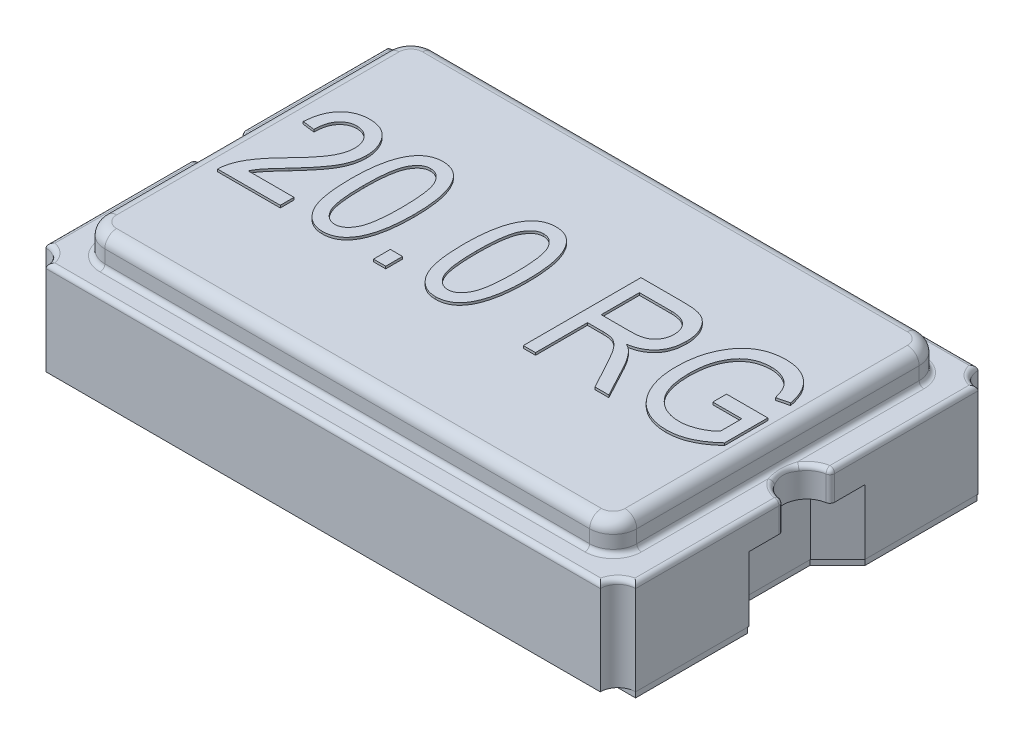
from build123d import *

# Parameters (mm, degrees)
EXTRUDE_6_DEPTH   = 0.05
EXTRUDE_6_2_DEPTH = 0.05
EXTRUDE_21_DEPTH  = 0.55
EXTRUDE_22_DEPTH  = 0.25
SKETCH_11_W       = 4.52
SKETCH_11_H       = 2.8
EXTRUDE_23_DEPTH  = 0.25
FILLET_1_R        = 0.2
FILLET_2_R        = 0.1
FILLET_5_R        = 0.04
FILLET_6_R        = 0.04
SKETCH_12_W       = 0.103896104
SKETCH_12_H       = 0.142857143
EXTRUDE_24_DEPTH  = 0.02


with BuildPart() as part:
    # Эскиз1 → Вытянуть6 (new body)
    with BuildSketch(Plane(origin=(0, 0, 0), x_dir=(1, 0, 0), z_dir=(0, 1, 0))):
        Polygon((-2.5, 0.5), (-2.5, 1.45), (-1.2, 1.45), (-1.2, -1.45), (-2.5, -1.45), (-2.5, -0.5), (-2.265625, -0.265625), (-2.265625, 0.265625), align=None)
    extrude(amount=EXTRUDE_6_DEPTH)



with BuildPart() as body_2:
    # Эскиз1 → Extrude 6 2 (new body)
    with BuildSketch(Plane(origin=(0, 0, 0), x_dir=(1, 0, 0), z_dir=(0, 1, 0))):
        Polygon((2.5, 0.5), (2.5, 1.45), (1.2, 1.45), (1.2, -1.45), (2.5, -1.45), (2.5, -0.5), (2.265625, -0.265625), (2.265625, 0.265625), align=None)
    extrude(amount=EXTRUDE_6_2_DEPTH)


with BuildPart() as part_1:
    add(part.part)

    add(body_2.part)  # Вытянуть21 merges body 2
    # Эскиз10 → Вытянуть21 (add)
    with BuildSketch(Plane(origin=(0, 0.05, 0), x_dir=(1, 0, 0), z_dir=(0, 1, 0))):
        with BuildLine():
            Line((-2.355, 1.605), (2.355, 1.605))
            ThreePointArc((2.355, 1.605), (2.398933983, 1.498933983), (2.505, 1.455))
            Line((2.505, 1.455), (2.505, 0.492726452))
            Line((2.505, 0.492726452), (2.273399929, 0.261126382))
            Line((2.273399929, 0.261126382), (2.273399929, -0.260815994))
            Line((2.273399929, -0.260815994), (2.505, -0.492416065))
            Line((2.505, -0.492416065), (2.505, -1.455))
            ThreePointArc((2.505, -1.455), (2.398933983, -1.498933983), (2.355, -1.605))
            Line((2.355, -1.605), (-2.355, -1.605))
            ThreePointArc((-2.355, -1.605), (-2.398933983, -1.498933983), (-2.505, -1.455))
            Line((-2.505, -1.455), (-2.505, -0.492416065))
            Line((-2.505, -0.492416065), (-2.273399929, -0.260815994))
            Line((-2.273399929, -0.260815994), (-2.273399929, 0.261126382))
            Line((-2.273399929, 0.261126382), (-2.505, 0.492726452))
            Line((-2.505, 0.492726452), (-2.505, 1.455))
            ThreePointArc((-2.505, 1.455), (-2.398933983, 1.498933983), (-2.355, 1.605))
        make_face()
    extrude(amount=EXTRUDE_21_DEPTH)

    # Эскиз9 → Вытянуть22 (add)
    with BuildSketch(Plane(origin=(0, 0.6, 1.605), x_dir=(-1, 0, 0), z_dir=(0, 1, 0))):
        with BuildLine():
            Line((2.355, -3.21), (-2.355, -3.21))
            ThreePointArc((-2.355, -3.21), (-2.398933983, -3.103933983), (-2.505, -3.06))
            Line((-2.505, -3.06), (-2.505, -1.805))
            ThreePointArc((-2.505, -1.805), (-2.305, -1.605), (-2.505, -1.405))
            Line((-2.505, -1.405), (-2.505, -0.15))
            ThreePointArc((-2.505, -0.15), (-2.398933983, -0.106066017), (-2.355, 0))
            Line((-2.355, 0), (2.355, 0))
            ThreePointArc((2.355, 0), (2.398933983, -0.106066017), (2.505, -0.15))
            Line((2.505, -0.15), (2.505, -1.405))
            ThreePointArc((2.505, -1.405), (2.305, -1.605), (2.505, -1.805))
            Line((2.505, -1.805), (2.505, -3.06))
            ThreePointArc((2.505, -3.06), (2.398933983, -3.103933983), (2.355, -3.21))
        make_face()
    extrude(amount=EXTRUDE_22_DEPTH)

    # Эскиз11 → Вытянуть23 (add)
    with BuildSketch(Plane(origin=(0, 0.85, 0), x_dir=(1, 0, 0), z_dir=(0, 1, 0))):
        Rectangle(SKETCH_11_W, SKETCH_11_H)
    extrude(amount=EXTRUDE_23_DEPTH)

    # Скругление1
    fillet_1_edges = [part_1.edges().sort_by_distance(p)[0] for p in [
        (-2.26, 0.975, -1.4),
        (-2.26, 0.975, 1.4),
        (2.26, 0.975, 1.4),
        (2.26, 0.975, -1.4),
    ]]
    fillet(fillet_1_edges, radius=FILLET_1_R)

    # Скругление2
    fillet_2_edges = [part_1.edges().sort_by_distance(p)[0] for p in [
        (2.26, 1.1, 0),
        (0, 1.1, 1.4),
        (-2.26, 1.1, 0),
        (0, 1.1, -1.4),
        (-2.201421356, 1.1, 1.341421356),
        (-2.201421356, 1.1, -1.341421356),
        (2.201421356, 1.1, -1.341421356),
        (2.201421356, 1.1, 1.341421356),
    ]]
    fillet(fillet_2_edges, radius=FILLET_2_R)

    # Скругление5
    fillet_5_edges = [part_1.edges().sort_by_distance(p)[0] for p in [
        (2.26, 0.85, 0),
        (0, 0.85, 1.4),
        (0, 0.85, -1.4),
        (-2.26, 0.85, 0),
        (2.201421356, 0.85, 1.341421356),
        (2.201421356, 0.85, -1.341421356),
        (-2.201421356, 0.85, -1.341421356),
        (-2.201421356, 0.85, 1.341421356),
        (-2.398933983, 0.85, -1.498933983),
        (-2.505, 0.85, -0.8275),
        (-2.505, 0.85, 0.8275),
        (-2.398933983, 0.85, 1.498933983),
        (0, 0.85, 1.605),
        (2.398933983, 0.85, 1.498933983),
        (2.505, 0.85, 0.8275),
        (2.505, 0.85, -0.8275),
        (2.398933983, 0.85, -1.498933983),
        (0, 0.85, -1.605),
    ]]
    fillet(fillet_5_edges, radius=FILLET_5_R)

    # Скругление6
    fillet_6_edges = [part_1.edges().sort_by_distance(p)[0] for p in [
        (2.505, 0.705, 0.2),
        (2.493196308, 0.838371965, 0.199651376),
        (2.505, 0.705, -0.2),
        (2.493196307, 0.838371965, -0.199651376),
        (-2.505, 0.705, -0.2),
        (-2.493196306, 0.838371967, -0.199651376),
        (-2.505, 0.705, 0.2),
        (-2.493196306, 0.838371967, 0.199651376),
        (2.305, 0.85, 0),
        (-2.305, 0.85, 0),
    ]]
    fillet(fillet_6_edges, radius=FILLET_6_R)

    # Эскиз12 → Вытянуть24 (add)
    # profile 1 of 6: a face of its own
    with BuildSketch(Plane(origin=(0, 1.1, 0), x_dir=(1, 0, 0), z_dir=(0, 1, 0))):
        with BuildLine():
            Line((-1.515584416, -0.336634927), (-1.515584416, -0.453518044))
            Line((-1.515584416, -0.453518044), (-2.048051948, -0.453518044))
            add(Edge.make_bspline(
                [(-2.048051948, -0.453518044), (-2.048076602, -0.447427945), (-2.04812655, -0.435089304), (-2.046465918, -0.416277957), (-2.043054005, -0.397011176), (-2.038697342, -0.37703194), (-2.032520067, -0.356603018), (-2.024957938, -0.335625147), (-2.01603529, -0.314150555), (-2.005587684, -0.292052059), (-1.993379129, -0.269117691), (-1.978646943, -0.2454434), (-1.961716008, -0.220604526), (-1.942563933, -0.194752492), (-1.920816148, -0.168132476), (-1.897118152, -0.140349305), (-1.871131741, -0.111460848), (-1.852629362, -0.092261311), (-1.843100649, -0.082373564)],
                knots=[0, 0, 0, 0, 0.672188691, 1.361865275, 2.08134618, 2.831455259, 3.618325166, 4.435686407, 5.292818481, 6.184803937, 7.133719261, 8.159707436, 9.261705982, 10.452168352, 11.710682541, 13.056179633, 14.483934645, 16, 16, 16, 16], degree=3))
            add(Edge.make_bspline(
                [(-1.843100649, -0.082373564), (-1.832027218, -0.070919994), (-1.810706186, -0.048867035), (-1.780698871, -0.016304491), (-1.753434211, 0.013961989), (-1.729456937, 0.042479713), (-1.708341364, 0.068860277), (-1.689875048, 0.093065962), (-1.674940492, 0.115646102), (-1.658815419, 0.14221488), (-1.643442452, 0.173844589), (-1.629851878, 0.21071402), (-1.621070628, 0.246355788), (-1.620000237, 0.269853646), (-1.619480519, 0.2812628)],
                knots=[0, 0, 0, 0, 1.312560889, 2.527233899, 3.64818266, 4.668586789, 5.596397896, 6.432357998, 7.175835261, 7.825761013, 8.992224112, 10.065918602, 11.060925749, 12, 12, 12, 12], degree=3))
            add(Edge.make_bspline(
                [(-1.619480519, 0.2812628), (-1.619552987, 0.287561562), (-1.619694524, 0.299863702), (-1.622099742, 0.317829661), (-1.625529901, 0.334918072), (-1.630058727, 0.351252434), (-1.63648008, 0.366564452), (-1.644173944, 0.380960362), (-1.653186214, 0.394505365), (-1.663470582, 0.407000547), (-1.674811901, 0.418272763), (-1.686764059, 0.428399433), (-1.699637983, 0.43659549), (-1.712904551, 0.443730323), (-1.727012067, 0.448901214), (-1.741663463, 0.452842769), (-1.756994292, 0.455065198), (-1.767404031, 0.455401965), (-1.772686688, 0.455572865)],
                knots=[0, 0, 0, 0, 1.164486654, 2.274364258, 3.346924328, 4.388668322, 5.404300818, 6.412115579, 7.404820287, 8.409522099, 9.400647826, 10.360464378, 11.301161788, 12.219192522, 13.141987859, 14.073903283, 15.022558797, 16, 16, 16, 16], degree=3))
            add(Edge.make_bspline(
                [(-1.772686688, 0.455572865), (-1.778382429, 0.455453375), (-1.789500775, 0.455220126), (-1.80570649, 0.452321466), (-1.821234542, 0.448443632), (-1.836006134, 0.44242945), (-1.849913219, 0.434725648), (-1.863156136, 0.425452657), (-1.875475671, 0.414435197), (-1.887119992, 0.401907027), (-1.897327722, 0.387620942), (-1.906699916, 0.372161837), (-1.914080124, 0.354874864), (-1.92035543, 0.336293067), (-1.925269982, 0.316199844), (-1.928554968, 0.294670976), (-1.93096401, 0.27171171), (-1.931099302, 0.255904383), (-1.931168831, 0.247780657)],
                knots=[0, 0, 0, 0, 0.928788257, 1.813037313, 2.680996359, 3.53827917, 4.408273621, 5.272359245, 6.172129225, 7.102295458, 8.058839945, 9.034325244, 10.048074492, 11.120300332, 12.234644845, 13.420320921, 14.674247329, 16, 16, 16, 16], degree=3))
            Line((-1.931168831, 0.247780657), (-2.035064935, 0.26076767))
            add(Edge.make_bspline(
                [(-2.035064935, 0.26076767), (-2.033994235, 0.272823987), (-2.031917029, 0.296213789), (-2.026467017, 0.330074158), (-2.018904145, 0.361490515), (-2.009926543, 0.390776276), (-1.998631686, 0.417567989), (-1.986003677, 0.442353233), (-1.971036462, 0.464593221), (-1.954345548, 0.484562901), (-1.936070715, 0.502280079), (-1.916314962, 0.517573151), (-1.895105115, 0.530464921), (-1.872683395, 0.541304821), (-1.848586331, 0.549399576), (-1.823246225, 0.555274566), (-1.796456978, 0.558755192), (-1.778175793, 0.559227529), (-1.768831169, 0.559468969)],
                knots=[0, 0, 0, 0, 1.296155121, 2.514599762, 3.669097984, 4.755193195, 5.79120272, 6.77953026, 7.729955905, 8.65570694, 9.562583864, 10.450894749, 11.325630111, 12.216772649, 13.112585423, 14.04224033, 14.999270054, 16, 16, 16, 16], degree=3))
            add(Edge.make_bspline(
                [(-1.768831169, 0.559468969), (-1.758741678, 0.559172803), (-1.739095765, 0.558596118), (-1.710495945, 0.554796226), (-1.683821384, 0.548093473), (-1.658952939, 0.538766487), (-1.63618927, 0.526487768), (-1.615160106, 0.511759109), (-1.596216399, 0.494132773), (-1.579358228, 0.474076491), (-1.564459845, 0.452423326), (-1.551460032, 0.429781562), (-1.540183738, 0.40652637), (-1.531370995, 0.382398984), (-1.524011417, 0.357723212), (-1.519387969, 0.332125001), (-1.516133095, 0.305899708), (-1.515768342, 0.288172489), (-1.515584416, 0.279233579)],
                knots=[0, 0, 0, 0, 1.141256367, 2.222215694, 3.255808886, 4.246221905, 5.218350639, 6.173592628, 7.142736081, 8.136099926, 9.131465336, 10.11177911, 11.087094076, 12.050634184, 13.014356534, 13.995714735, 14.989343724, 16, 16, 16, 16], degree=3))
            add(Edge.make_bspline(
                [(-1.515584416, 0.279233579), (-1.515757709, 0.271180013), (-1.516102038, 0.255177805), (-1.518341927, 0.231301602), (-1.522295746, 0.207746397), (-1.527429606, 0.184285699), (-1.534714589, 0.161282762), (-1.542961578, 0.138372245), (-1.552964536, 0.115812608), (-1.564773277, 0.093163493), (-1.578599779, 0.069623402), (-1.5951685, 0.044762703), (-1.614172174, 0.017916859), (-1.636382701, -0.010435796), (-1.660723869, -0.041110606), (-1.68827103, -0.073334654), (-1.718486723, -0.107392099), (-1.739774558, -0.130501168), (-1.750771104, -0.142438499)],
                knots=[0, 0, 0, 0, 0.78053567, 1.550902233, 2.321464013, 3.094364546, 3.87611052, 4.657966429, 5.453363508, 6.265521698, 7.132350641, 8.097801917, 9.160103787, 10.319208993, 11.587678713, 12.955014444, 14.427067756, 16, 16, 16, 16], degree=3))
            add(Edge.make_bspline(
                [(-1.750771104, -0.142438499), (-1.757752087, -0.149865925), (-1.771093306, -0.164060332), (-1.789986071, -0.184599818), (-1.806939674, -0.203284333), (-1.822323226, -0.219850833), (-1.835376199, -0.234856451), (-1.846692969, -0.247904793), (-1.85593964, -0.259156692), (-1.869797496, -0.27684538), (-1.887275844, -0.301768582), (-1.89935125, -0.325264657), (-1.905194805, -0.336634927)],
                knots=[0, 0, 0, 0, 1.227496676, 2.345844757, 3.360613726, 4.265798447, 5.068085109, 5.75545707, 6.345771879, 6.821573405, 8.46188917, 10, 10, 10, 10], degree=3))
            Line((-1.905194805, -0.336634927), (-1.515584416, -0.336634927))
        make_face()
    # profile 2 of 6: a face of its own
    with BuildSketch(Plane(origin=(0, 1.1, 0), x_dir=(1, 0, 0), z_dir=(0, 1, 0))):
        with BuildLine():
            add(Edge.make_bspline(
                [(-1.411688312, 0.046076112), (-1.411523328, 0.06650825), (-1.41120297, 0.10618255), (-1.407892135, 0.163725629), (-1.402669969, 0.217483649), (-1.395568528, 0.267384527), (-1.385957565, 0.313435753), (-1.374639694, 0.355711211), (-1.360739093, 0.39407646), (-1.345093107, 0.428696009), (-1.32715076, 0.459376551), (-1.307370081, 0.486223515), (-1.285164304, 0.508801175), (-1.261145725, 0.527575378), (-1.234836527, 0.541878035), (-1.206611173, 0.552157063), (-1.176365323, 0.558359848), (-1.155494628, 0.559094253), (-1.144845779, 0.559468969)],
                knots=[0, 0, 0, 0, 1.522295809, 2.955932353, 4.292935845, 5.545987552, 6.709403679, 7.796379217, 8.803980711, 9.746667296, 10.623167879, 11.447716403, 12.224665142, 12.975696349, 13.710987297, 14.4460191, 15.207112772, 16, 16, 16, 16], degree=3))
            add(Edge.make_bspline(
                [(-1.144845779, 0.559468969), (-1.135355954, 0.559164541), (-1.11672011, 0.558566716), (-1.089525699, 0.553636707), (-1.063947598, 0.545249609), (-1.039966488, 0.533594041), (-1.017655214, 0.518545654), (-0.99679426, 0.500350276), (-0.977612231, 0.47864105), (-0.96650478, 0.462332318), (-0.960795455, 0.453949488)],
                knots=[0, 0, 0, 0, 1.02435884, 2.0116063, 2.972586715, 3.92329494, 4.881606269, 5.870473939, 6.905405214, 8, 8, 8, 8], degree=3))
            add(Edge.make_bspline(
                [(-0.960795455, 0.453949488), (-0.954186747, 0.442647536), (-0.940443243, 0.419143933), (-0.924032833, 0.379764164), (-0.910200371, 0.335780267), (-0.898537401, 0.28705226), (-0.890217938, 0.233479667), (-0.883633593, 0.175270882), (-0.879822897, 0.112279589), (-0.879426299, 0.068673196), (-0.879220779, 0.046076112)],
                knots=[0, 0, 0, 0, 0.745747152, 1.550859881, 2.42529298, 3.372802996, 4.404287875, 5.514077945, 6.711780846, 8, 8, 8, 8], degree=3))
            add(Edge.make_bspline(
                [(-0.879220779, 0.046076112), (-0.879383763, 0.025778995), (-0.879700176, -0.013625443), (-0.883044144, -0.070894479), (-0.888196731, -0.124391268), (-0.895394626, -0.174139948), (-0.904916457, -0.220078117), (-0.91638471, -0.262342079), (-0.929851493, -0.30091312), (-0.945714052, -0.33553636), (-0.963392273, -0.366395903), (-0.983508508, -0.392970813), (-1.005179126, -0.415952012), (-1.029509477, -0.43431957), (-1.055639162, -0.449027063), (-1.08405474, -0.459132844), (-1.114401412, -0.465422566), (-1.135344455, -0.466138589), (-1.146063312, -0.466505057)],
                knots=[0, 0, 0, 0, 1.513874866, 2.939007974, 4.277477108, 5.521918538, 6.686610019, 7.774777114, 8.786532326, 9.730252297, 10.61206932, 11.433487149, 12.211385775, 12.960169701, 13.698700869, 14.439280195, 15.201208188, 16, 16, 16, 16], degree=3))
            add(Edge.make_bspline(
                [(-1.146063312, -0.466505057), (-1.155623702, -0.46614622), (-1.174420506, -0.465440706), (-1.202000363, -0.460076557), (-1.228103193, -0.450827771), (-1.252866881, -0.43812138), (-1.276324347, -0.42187637), (-1.298188984, -0.401750559), (-1.318989048, -0.378273725), (-1.338474377, -0.35101305), (-1.356082337, -0.319267794), (-1.370966716, -0.282282366), (-1.383647752, -0.240233435), (-1.393710767, -0.192951237), (-1.402180801, -0.140629029), (-1.407503893, -0.08300438), (-1.411032101, -0.020188487), (-1.411463861, 0.023410969), (-1.411688312, 0.046076112)],
                knots=[0, 0, 0, 0, 0.713782411, 1.403376538, 2.088831486, 2.775699897, 3.476400496, 4.213162367, 4.989742879, 5.815463779, 6.710980744, 7.6941898, 8.787315853, 9.987366569, 11.302150399, 12.743876293, 14.307306722, 16, 16, 16, 16], degree=3))
        make_face()
        with BuildLine():
            add(Edge.make_bspline(
                [(-1.307792208, 0.046481956), (-1.307611045, 0.027000043), (-1.30726497, -0.010216195), (-1.305363086, -0.06362203), (-1.30176834, -0.111954442), (-1.296775606, -0.155365719), (-1.29044564, -0.193676542), (-1.282633006, -0.22709784), (-1.273323485, -0.255493717), (-1.262370832, -0.279268475), (-1.250225099, -0.29900458), (-1.23725189, -0.315822075), (-1.223837996, -0.330407322), (-1.209174787, -0.342057977), (-1.193951618, -0.351478352), (-1.177580243, -0.357625169), (-1.160638139, -0.362061897), (-1.148933759, -0.362425316), (-1.143019481, -0.362608953)],
                knots=[0, 0, 0, 0, 1.930873368, 3.688541263, 5.295281011, 6.732986767, 8.018032389, 9.141589856, 10.131594649, 10.974379403, 11.729767228, 12.422984227, 13.077418253, 13.687793181, 14.274134012, 14.843047171, 15.415386244, 16, 16, 16, 16], degree=3))
            add(Edge.make_bspline(
                [(-1.143019481, -0.362608953), (-1.137444381, -0.362416409), (-1.126343471, -0.362033024), (-1.110161842, -0.357641593), (-1.094562007, -0.351199853), (-1.079806142, -0.341877012), (-1.065915436, -0.329886024), (-1.052701627, -0.315327878), (-1.040145039, -0.29818657), (-1.028104024, -0.278154513), (-1.017267739, -0.254258972), (-1.00805065, -0.225728161), (-1.000294972, -0.192317584), (-0.993879638, -0.154026699), (-0.989231929, -0.110787059), (-0.985510965, -0.062746558), (-0.983658461, -0.009741714), (-0.983302586, 0.027203316), (-0.983116883, 0.046481956)],
                knots=[0, 0, 0, 0, 0.556098029, 1.107279675, 1.665020537, 2.239289732, 2.843790749, 3.494855459, 4.20099618, 4.965402842, 5.827994078, 6.818278647, 7.958442113, 9.254955883, 10.697998423, 12.305588537, 14.072183745, 16, 16, 16, 16], degree=3))
            add(Edge.make_bspline(
                [(-0.983116883, 0.046481956), (-0.983301759, 0.065963637), (-0.98365621, 0.10331461), (-0.985517166, 0.156791099), (-0.989177137, 0.205251974), (-0.994081539, 0.248609361), (-1.000532838, 0.286962017), (-1.00819074, 0.320359983), (-1.017652477, 0.348698723), (-1.028449588, 0.372426059), (-1.040842531, 0.391986593), (-1.053495977, 0.409059347), (-1.067362322, 0.423283734), (-1.081937349, 0.435128276), (-1.097433326, 0.444357975), (-1.113918254, 0.450953342), (-1.131263964, 0.454922118), (-1.143134438, 0.455355038), (-1.149107143, 0.455572865)],
                knots=[0, 0, 0, 0, 1.926173374, 3.692928135, 5.28908838, 6.72993665, 8.005261178, 9.132588719, 10.113846285, 10.954579593, 11.702439438, 12.399284011, 13.051919516, 13.660808713, 14.251466784, 14.827675714, 15.41013748, 16, 16, 16, 16], degree=3))
            add(Edge.make_bspline(
                [(-1.149107143, 0.455572865), (-1.15468315, 0.455385408), (-1.165720149, 0.45501436), (-1.181767238, 0.45060442), (-1.197162046, 0.444156348), (-1.211809817, 0.434792038), (-1.22552572, 0.422632062), (-1.238846685, 0.408164083), (-1.25112789, 0.390868185), (-1.26321306, 0.371019511), (-1.273859316, 0.34706006), (-1.283090705, 0.318578881), (-1.290515403, 0.285108368), (-1.297076323, 0.246932702), (-1.30166464, 0.203748319), (-1.305401991, 0.155711288), (-1.307249519, 0.10270539), (-1.307606124, 0.065760515), (-1.307792208, 0.046481956)],
                knots=[0, 0, 0, 0, 0.557102101, 1.102712893, 1.655222221, 2.224793741, 2.834805151, 3.487045402, 4.190458401, 4.956245252, 5.811421647, 6.809929224, 7.950602775, 9.242777249, 10.688425301, 12.298918027, 14.068702942, 16, 16, 16, 16], degree=3))
        make_face(mode=Mode.SUBTRACT)
    # profile 3 of 6: a face of its own
    with BuildSketch(Plane(origin=(0, 1.1, 0), x_dir=(1, 0, 0), z_dir=(0, 1, 0))):
        with Locations((-0.671428571, -0.382089473)):
            Rectangle(SKETCH_12_W, SKETCH_12_H)
    # profile 4 of 6: a face of its own
    with BuildSketch(Plane(origin=(0, 1.1, 0), x_dir=(1, 0, 0), z_dir=(0, 1, 0))):
        with BuildLine():
            add(Edge.make_bspline(
                [(-0.450649351, 0.046076112), (-0.450484367, 0.06650825), (-0.450164009, 0.10618255), (-0.446853174, 0.163725629), (-0.441631008, 0.217483649), (-0.434529567, 0.267384527), (-0.424918604, 0.313435753), (-0.413600733, 0.355711211), (-0.399700132, 0.39407646), (-0.384054146, 0.428696009), (-0.366111799, 0.459376551), (-0.34633112, 0.486223515), (-0.324125343, 0.508801175), (-0.300106764, 0.527575378), (-0.273797566, 0.541878035), (-0.245572212, 0.552157063), (-0.215326362, 0.558359848), (-0.194455667, 0.559094253), (-0.183806818, 0.559468969)],
                knots=[0, 0, 0, 0, 1.522295809, 2.955932353, 4.292935845, 5.545987552, 6.709403679, 7.796379217, 8.803980711, 9.746667296, 10.623167879, 11.447716403, 12.224665142, 12.975696349, 13.710987297, 14.4460191, 15.207112772, 16, 16, 16, 16], degree=3))
            add(Edge.make_bspline(
                [(-0.183806818, 0.559468969), (-0.174316993, 0.559164541), (-0.155681149, 0.558566716), (-0.128486738, 0.553636707), (-0.102908637, 0.545249609), (-0.078927527, 0.533594041), (-0.056616253, 0.518545654), (-0.035755299, 0.500350276), (-0.01657327, 0.47864105), (-0.005465819, 0.462332318), (0.000243506, 0.453949488)],
                knots=[0, 0, 0, 0, 1.02435884, 2.0116063, 2.972586715, 3.92329494, 4.881606269, 5.870473939, 6.905405214, 8, 8, 8, 8], degree=3))
            add(Edge.make_bspline(
                [(0.000243506, 0.453949488), (0.006852214, 0.442647536), (0.020595718, 0.419143933), (0.037006128, 0.379764164), (0.05083859, 0.335780267), (0.06250156, 0.28705226), (0.070821023, 0.233479667), (0.077405368, 0.175270882), (0.081216064, 0.112279589), (0.081612662, 0.068673196), (0.081818182, 0.046076112)],
                knots=[0, 0, 0, 0, 0.745747152, 1.550859881, 2.42529298, 3.372802996, 4.404287875, 5.514077945, 6.711780846, 8, 8, 8, 8], degree=3))
            add(Edge.make_bspline(
                [(0.081818182, 0.046076112), (0.081655198, 0.025778995), (0.081338785, -0.013625443), (0.077994818, -0.070894479), (0.07284223, -0.124391268), (0.065644335, -0.174139948), (0.056122504, -0.220078117), (0.044654251, -0.262342079), (0.031187468, -0.30091312), (0.015324909, -0.33553636), (-0.002353312, -0.366395903), (-0.022469547, -0.392970813), (-0.044140165, -0.415952012), (-0.068470516, -0.43431957), (-0.094600201, -0.449027063), (-0.123015779, -0.459132844), (-0.153362451, -0.465422566), (-0.174305494, -0.466138589), (-0.185024351, -0.466505057)],
                knots=[0, 0, 0, 0, 1.513874866, 2.939007974, 4.277477108, 5.521918538, 6.686610019, 7.774777114, 8.786532326, 9.730252297, 10.61206932, 11.433487149, 12.211385775, 12.960169701, 13.698700869, 14.439280195, 15.201208188, 16, 16, 16, 16], degree=3))
            add(Edge.make_bspline(
                [(-0.185024351, -0.466505057), (-0.194584741, -0.46614622), (-0.213381545, -0.465440706), (-0.240961402, -0.460076557), (-0.267064232, -0.450827771), (-0.29182792, -0.43812138), (-0.315285386, -0.42187637), (-0.337150023, -0.401750559), (-0.357950087, -0.378273725), (-0.377435416, -0.35101305), (-0.395043376, -0.319267794), (-0.409927755, -0.282282366), (-0.422608791, -0.240233435), (-0.432671806, -0.192951237), (-0.44114184, -0.140629029), (-0.446464932, -0.08300438), (-0.44999314, -0.020188487), (-0.4504249, 0.023410969), (-0.450649351, 0.046076112)],
                knots=[0, 0, 0, 0, 0.713782411, 1.403376538, 2.088831486, 2.775699897, 3.476400496, 4.213162367, 4.989742879, 5.815463779, 6.710980744, 7.6941898, 8.787315853, 9.987366569, 11.302150399, 12.743876293, 14.307306722, 16, 16, 16, 16], degree=3))
        make_face()
        with BuildLine():
            add(Edge.make_bspline(
                [(-0.346753247, 0.046481956), (-0.346572084, 0.027000043), (-0.346226009, -0.010216195), (-0.344324125, -0.06362203), (-0.340729379, -0.111954442), (-0.335736645, -0.155365719), (-0.329406679, -0.193676542), (-0.321594045, -0.22709784), (-0.312284524, -0.255493717), (-0.301331871, -0.279268475), (-0.289186138, -0.29900458), (-0.276212929, -0.315822075), (-0.262799035, -0.330407322), (-0.248135826, -0.342057977), (-0.232912657, -0.351478352), (-0.216541281, -0.357625169), (-0.199599178, -0.362061897), (-0.187894798, -0.362425316), (-0.181980519, -0.362608953)],
                knots=[0, 0, 0, 0, 1.930873368, 3.688541263, 5.295281011, 6.732986767, 8.018032389, 9.141589856, 10.131594649, 10.974379403, 11.729767228, 12.422984227, 13.077418253, 13.687793181, 14.274134012, 14.843047171, 15.415386244, 16, 16, 16, 16], degree=3))
            add(Edge.make_bspline(
                [(-0.181980519, -0.362608953), (-0.17640542, -0.362416409), (-0.16530451, -0.362033024), (-0.149122881, -0.357641593), (-0.133523046, -0.351199853), (-0.118767181, -0.341877012), (-0.104876475, -0.329886024), (-0.091662666, -0.315327878), (-0.079106078, -0.29818657), (-0.067065063, -0.278154513), (-0.056228778, -0.254258972), (-0.047011689, -0.225728161), (-0.039256011, -0.192317584), (-0.032840677, -0.154026699), (-0.028192968, -0.110787059), (-0.024472004, -0.062746558), (-0.0226195, -0.009741714), (-0.022263625, 0.027203316), (-0.022077922, 0.046481956)],
                knots=[0, 0, 0, 0, 0.556098029, 1.107279675, 1.665020537, 2.239289732, 2.843790749, 3.494855459, 4.20099618, 4.965402842, 5.827994078, 6.818278647, 7.958442113, 9.254955883, 10.697998423, 12.305588537, 14.072183745, 16, 16, 16, 16], degree=3))
            add(Edge.make_bspline(
                [(-0.022077922, 0.046481956), (-0.022262798, 0.065963637), (-0.022617249, 0.10331461), (-0.024478205, 0.156791099), (-0.028138176, 0.205251974), (-0.033042578, 0.248609361), (-0.039493877, 0.286962017), (-0.047151779, 0.320359983), (-0.056613516, 0.348698723), (-0.067410627, 0.372426059), (-0.07980357, 0.391986593), (-0.092457016, 0.409059347), (-0.106323361, 0.423283734), (-0.120898388, 0.435128276), (-0.136394365, 0.444357975), (-0.152879293, 0.450953342), (-0.170225003, 0.454922118), (-0.182095476, 0.455355038), (-0.188068182, 0.455572865)],
                knots=[0, 0, 0, 0, 1.926173374, 3.692928135, 5.28908838, 6.72993665, 8.005261178, 9.132588719, 10.113846285, 10.954579593, 11.702439438, 12.399284011, 13.051919516, 13.660808713, 14.251466784, 14.827675714, 15.41013748, 16, 16, 16, 16], degree=3))
            add(Edge.make_bspline(
                [(-0.188068182, 0.455572865), (-0.193644189, 0.455385408), (-0.204681188, 0.45501436), (-0.220728277, 0.45060442), (-0.236123085, 0.444156348), (-0.250770856, 0.434792038), (-0.264486759, 0.422632062), (-0.277807724, 0.408164083), (-0.290088929, 0.390868185), (-0.302174099, 0.371019511), (-0.312820355, 0.34706006), (-0.322051744, 0.318578881), (-0.329476442, 0.285108368), (-0.336037362, 0.246932702), (-0.340625679, 0.203748319), (-0.34436303, 0.155711288), (-0.346210558, 0.10270539), (-0.346567163, 0.065760515), (-0.346753247, 0.046481956)],
                knots=[0, 0, 0, 0, 0.557102101, 1.102712893, 1.655222221, 2.224793741, 2.834805151, 3.487045402, 4.190458401, 4.956245252, 5.811421647, 6.809929224, 7.950602775, 9.242777249, 10.688425301, 12.298918027, 14.068702942, 16, 16, 16, 16], degree=3))
        make_face(mode=Mode.SUBTRACT)
    # profile 5 of 6: a face of its own
    with BuildSketch(Plane(origin=(0, 1.1, 0), x_dir=(1, 0, 0), z_dir=(0, 1, 0))):
        with BuildLine():
            Line((0.549350649, -0.453518044), (0.549350649, 0.546481956))
            Line((0.549350649, 0.546481956), (0.91663961, 0.546481956))
            add(Edge.make_bspline(
                [(0.91663961, 0.546481956), (0.92590856, 0.546428603), (0.943849566, 0.546325332), (0.969839711, 0.544839726), (0.994006484, 0.542640561), (1.016317687, 0.539716528), (1.036643074, 0.535662661), (1.055063249, 0.53074503), (1.071728068, 0.525255926), (1.091291936, 0.516201598), (1.11361183, 0.502157439), (1.13768382, 0.480760453), (1.15876892, 0.454263047), (1.177531532, 0.423818574), (1.192939969, 0.389636638), (1.203854454, 0.352359162), (1.210443314, 0.312475923), (1.211266094, 0.285008784), (1.211688312, 0.270913774)],
                knots=[0, 0, 0, 0, 0.957775898, 1.853873864, 2.6892683, 3.465319774, 4.178195347, 4.829309051, 5.435011313, 5.988660553, 7.053440284, 8.147710094, 9.30058322, 10.540256924, 11.835580405, 13.162637032, 14.543981594, 16, 16, 16, 16], degree=3))
            add(Edge.make_bspline(
                [(1.211688312, 0.270913774), (1.211467554, 0.261573372), (1.211036345, 0.243328647), (1.208424194, 0.216587839), (1.203884879, 0.191222778), (1.196942777, 0.167299098), (1.18889164, 0.144519506), (1.178319461, 0.123283316), (1.1661899, 0.103316262), (1.152091908, 0.084777049), (1.136322787, 0.067707019), (1.118625234, 0.052374492), (1.099343361, 0.03856175), (1.078326824, 0.026390078), (1.055705692, 0.015703676), (1.031212388, 0.00717638), (1.005228645, -0.000291196), (0.987154732, -0.003716405), (0.977922078, -0.005466096)],
                knots=[0, 0, 0, 0, 1.121977975, 2.191573688, 3.224240956, 4.211948119, 5.180998842, 6.122125515, 7.055751929, 7.983633331, 8.914994346, 9.842128418, 10.791356962, 11.759862547, 12.75578979, 13.791489111, 14.871831714, 16, 16, 16, 16], degree=3))
            add(Edge.make_bspline(
                [(0.977922078, -0.005466096), (0.984736715, -0.00923647), (0.99770914, -0.016413798), (1.015462376, -0.027993729), (1.030634554, -0.039649501), (1.039211527, -0.048131552), (1.043262987, -0.052138174)],
                knots=[0, 0, 0, 0, 1.158843086, 2.205987482, 3.152571606, 4, 4, 4, 4], degree=3))
            add(Edge.make_bspline(
                [(1.043262987, -0.052138174), (1.051366464, -0.061919396), (1.067664541, -0.081591829), (1.090006611, -0.11297673), (1.111407371, -0.145625805), (1.123974904, -0.168592747), (1.130316558, -0.180182005)],
                knots=[0, 0, 0, 0, 0.982253192, 1.975551771, 2.978451105, 4, 4, 4, 4], degree=3))
            Line((1.130316558, -0.180182005), (1.276623377, -0.453518044))
            Line((1.276623377, -0.453518044), (1.158522727, -0.453518044))
            Line((1.158522727, -0.453518044), (1.043060065, -0.239638174))
            add(Edge.make_bspline(
                [(1.043060065, -0.239638174), (1.037681291, -0.229609628), (1.027392979, -0.210427415), (1.012124058, -0.1831915), (0.997930526, -0.15862874), (0.984836355, -0.136715178), (0.972647492, -0.117683296), (0.961700119, -0.101271568), (0.951674359, -0.087666889), (0.939675112, -0.073649962), (0.925727937, -0.059119983), (0.909148137, -0.044527329), (0.892587593, -0.033214808), (0.875726691, -0.024599957), (0.857166458, -0.018924748), (0.836252728, -0.014676782), (0.812050018, -0.012366209), (0.79489085, -0.012100874), (0.78575487, -0.011959603)],
                knots=[0, 0, 0, 0, 1.483643366, 2.83785556, 4.070616892, 5.1822306, 6.165666296, 7.016844219, 7.754091418, 8.367230408, 9.421242841, 10.377779407, 11.241203819, 12.029974219, 12.835959019, 13.762973995, 14.808950166, 16, 16, 16, 16], degree=3))
            Line((0.78575487, -0.011959603), (0.653246753, -0.011959603))
            Line((0.653246753, -0.011959603), (0.653246753, -0.453518044))
            Line((0.653246753, -0.453518044), (0.549350649, -0.453518044))
        make_face()
        with BuildLine():
            Line((0.653246753, 0.104923514), (0.896956169, 0.104923514))
            add(Edge.make_bspline(
                [(0.896956169, 0.104923514), (0.909476207, 0.105167406), (0.93293998, 0.105624482), (0.965765792, 0.108660131), (0.993783563, 0.114153512), (1.017516638, 0.122154371), (1.037754141, 0.13275578), (1.055373539, 0.145883963), (1.070828071, 0.161562794), (1.0839738, 0.17969823), (1.094843062, 0.199894225), (1.102178936, 0.222095431), (1.107158233, 0.245665382), (1.107577442, 0.261958067), (1.107792208, 0.270305008)],
                knots=[0, 0, 0, 0, 1.47306528, 2.760668081, 3.873497699, 4.82484281, 5.696997418, 6.550136397, 7.399890849, 8.276969651, 9.17766846, 10.086208714, 11.019541422, 12, 12, 12, 12], degree=3))
            add(Edge.make_bspline(
                [(1.107792208, 0.270305008), (1.107604637, 0.276328966), (1.107238961, 0.28807283), (1.105314988, 0.305229494), (1.101559962, 0.321374381), (1.096605436, 0.33659425), (1.089944363, 0.350750051), (1.082165806, 0.364065234), (1.072369611, 0.375992362), (1.061709067, 0.38728379), (1.049371857, 0.397308001), (1.035594465, 0.405993753), (1.020379668, 0.413289943), (1.00387354, 0.419546124), (0.985741069, 0.423707519), (0.966407209, 0.427311731), (0.945631621, 0.429309947), (0.931321498, 0.429500574), (0.923944805, 0.429598839)],
                knots=[0, 0, 0, 0, 1.045235731, 2.037714497, 2.988326782, 3.915852726, 4.808207886, 5.697550021, 6.58254782, 7.478674216, 8.387536059, 9.331464042, 10.296946822, 11.310355404, 12.385965615, 13.518246496, 14.720686494, 16, 16, 16, 16], degree=3))
            Line((0.923944805, 0.429598839), (0.653246753, 0.429598839))
            Line((0.653246753, 0.429598839), (0.653246753, 0.104923514))
        make_face(mode=Mode.SUBTRACT)
    # profile 6 of 6: a face of its own
    with BuildSketch(Plane(origin=(0, 1.1, 0), x_dir=(1, 0, 0), z_dir=(0, 1, 0))):
        with BuildLine():
            Line((1.77012987, -0.063907654), (1.77012987, 0.052975462))
            Line((1.77012987, 0.052975462), (2.120779221, 0.052975462))
            Line((2.120779221, 0.052975462), (2.120779221, -0.313298888))
            add(Edge.make_bspline(
                [(2.120779221, -0.313298888), (2.107444339, -0.325433246), (2.081345846, -0.349182123), (2.039750605, -0.380189113), (1.997637971, -0.406841929), (1.954781423, -0.428618014), (1.911258052, -0.445721299), (1.867095419, -0.457663131), (1.822260181, -0.465072223), (1.792141022, -0.466026343), (1.777029221, -0.466505057)],
                knots=[0, 0, 0, 0, 1.121144615, 2.194259096, 3.22291754, 4.218514423, 5.180530362, 6.126881594, 7.060193117, 8, 8, 8, 8], degree=3))
            add(Edge.make_bspline(
                [(1.777029221, -0.466505057), (1.767081647, -0.466273858), (1.747355539, -0.465815388), (1.718177663, -0.463263374), (1.689790295, -0.458495539), (1.662251635, -0.452054781), (1.635477902, -0.443765918), (1.609703396, -0.433215653), (1.584447169, -0.421424665), (1.560301399, -0.407303901), (1.537176249, -0.39150256), (1.515224219, -0.373982685), (1.494401966, -0.354922974), (1.475087253, -0.333814692), (1.456926391, -0.311127037), (1.439689397, -0.28693649), (1.424163567, -0.260744125), (1.409480399, -0.233090964), (1.396572787, -0.203712059), (1.385356687, -0.172860446), (1.375879011, -0.140584823), (1.367928374, -0.106866375), (1.361854488, -0.071694431), (1.357708673, -0.035103366), (1.354931989, 0.002878379), (1.354675775, 0.02868735), (1.354545455, 0.041814748)],
                knots=[0, 0, 0, 0, 0.963545397, 1.910717405, 2.833679837, 3.748938136, 4.648160849, 5.544707014, 6.44428759, 7.345417256, 8.250301349, 9.15471106, 10.063381295, 10.981308332, 11.922549023, 12.876762963, 13.855312354, 14.869185747, 15.907484256, 16.960251447, 18.046404778, 19.163470092, 20.313696906, 21.500864286, 22.728847097, 24, 24, 24, 24], degree=3))
            add(Edge.make_bspline(
                [(1.354545455, 0.041814748), (1.354681272, 0.055144423), (1.35494836, 0.08135753), (1.357654062, 0.120030326), (1.362099618, 0.157340217), (1.368221339, 0.193361473), (1.37579198, 0.228186438), (1.385625759, 0.26160415), (1.396937295, 0.293745593), (1.409988894, 0.324392695), (1.424246513, 0.353517731), (1.439925679, 0.380708009), (1.456503522, 0.406045116), (1.474504324, 0.429112942), (1.49309118, 0.450638859), (1.513060684, 0.469895195), (1.534011576, 0.487314641), (1.556247188, 0.50249939), (1.579427409, 0.515970416), (1.603702, 0.527514713), (1.628890112, 0.537508154), (1.655119061, 0.545691163), (1.682443044, 0.551671987), (1.710764777, 0.556116453), (1.740100614, 0.559120903), (1.760043894, 0.559352063), (1.77012987, 0.559468969)],
                knots=[0, 0, 0, 0, 1.283121513, 2.523287582, 3.730023389, 4.899079804, 6.039789461, 7.15880579, 8.250410031, 9.318392136, 10.363902253, 11.370311636, 12.338384822, 13.276198214, 14.185288112, 15.074093801, 15.943727649, 16.805327304, 17.663128848, 18.522362821, 19.39060582, 20.270106898, 21.164311373, 22.080741752, 23.02936765, 24, 24, 24, 24], degree=3))
            add(Edge.make_bspline(
                [(1.77012987, 0.559468969), (1.78483206, 0.559119203), (1.813432607, 0.558438793), (1.854898511, 0.552014287), (1.893575118, 0.541555248), (1.92931436, 0.526607878), (1.962122704, 0.507869189), (1.991991419, 0.485603305), (2.018838246, 0.459814609), (2.03847077, 0.435334657), (2.05270021, 0.413922939), (2.062700761, 0.396279804), (2.07201878, 0.377252374), (2.080485755, 0.35666909), (2.088386376, 0.334725986), (2.095719192, 0.311393146), (2.102174968, 0.2865832), (2.105890586, 0.269507082), (2.107792208, 0.26076767)],
                knots=[0, 0, 0, 0, 1.421442541, 2.765168547, 4.047841273, 5.288586259, 6.501956771, 7.694182091, 8.88353085, 10.093491299, 10.721426975, 11.369099503, 12.053886711, 12.769643166, 13.521004755, 14.309514717, 15.134823968, 16, 16, 16, 16], degree=3))
            Line((2.107792208, 0.26076767), (2.003896104, 0.234793644))
            add(Edge.make_bspline(
                [(2.003896104, 0.234793644), (2.000504023, 0.247567192), (1.994117867, 0.271615522), (1.982191852, 0.304750262), (1.968913268, 0.332769976), (1.954067396, 0.356256422), (1.937010481, 0.375807548), (1.91811798, 0.39311045), (1.896305304, 0.407574961), (1.872626873, 0.420302199), (1.846799373, 0.430079794), (1.819449609, 0.437530774), (1.79042109, 0.441798644), (1.770549376, 0.442319536), (1.76038961, 0.442585852)],
                knots=[0, 0, 0, 0, 1.35370667, 2.548578037, 3.602482135, 4.525244969, 5.385205021, 6.25372376, 7.141792941, 8.059466754, 9.00287123, 9.96447941, 10.959304047, 12, 12, 12, 12], degree=3))
            add(Edge.make_bspline(
                [(1.76038961, 0.442585852), (1.752944277, 0.442488272), (1.738295171, 0.442296278), (1.716666449, 0.4401984), (1.69585519, 0.436788719), (1.675816075, 0.432027137), (1.656495238, 0.426347957), (1.638167287, 0.41861224), (1.620498075, 0.409956251), (1.603563752, 0.399978528), (1.587411514, 0.38858371), (1.572232527, 0.37551013), (1.557754668, 0.36114217), (1.544336432, 0.345023506), (1.53132592, 0.327747164), (1.519402045, 0.308734294), (1.508171758, 0.288365045), (1.497917529, 0.26652354), (1.488513337, 0.243330796), (1.480422398, 0.218865167), (1.473809502, 0.193065053), (1.468008843, 0.166155671), (1.463941323, 0.137863282), (1.460549354, 0.108375511), (1.458802329, 0.077618082), (1.458563043, 0.056697479), (1.458441558, 0.046076112)],
                knots=[0, 0, 0, 0, 0.95244652, 1.873991161, 2.777557121, 3.648832578, 4.508552549, 5.350797697, 6.190771618, 7.02501797, 7.86316154, 8.7165405, 9.585620601, 10.469996113, 11.397859992, 12.351132043, 13.338946381, 14.372712626, 15.436726846, 16.539770861, 17.66713286, 18.84353329, 20.060284837, 21.322933361, 22.640856277, 24, 24, 24, 24], degree=3))
            add(Edge.make_bspline(
                [(1.458441558, 0.046076112), (1.458710141, 0.030103441), (1.459231152, -0.000881212), (1.46335632, -0.045824099), (1.46988083, -0.087781806), (1.479385682, -0.126619265), (1.491554511, -0.162368983), (1.506337896, -0.19509791), (1.524006049, -0.224681137), (1.544442649, -0.250997049), (1.567031391, -0.27413341), (1.591285785, -0.294364563), (1.617145824, -0.311590021), (1.644831975, -0.325369261), (1.673937854, -0.336484234), (1.704797664, -0.344157837), (1.737260086, -0.348630144), (1.759428566, -0.349286881), (1.770738636, -0.34962194)],
                knots=[0, 0, 0, 0, 1.344305217, 2.607756079, 3.795613497, 4.915552292, 5.968887625, 6.970219091, 7.933010886, 8.862341374, 9.768284732, 10.649651063, 11.516609893, 12.377263757, 13.247581458, 14.134137142, 15.048060964, 16, 16, 16, 16], degree=3))
            add(Edge.make_bspline(
                [(1.770738636, -0.34962194), (1.781854199, -0.349271227), (1.804429406, -0.348558945), (1.838386914, -0.342610964), (1.872655815, -0.332943257), (1.906559152, -0.319907171), (1.938873601, -0.304322832), (1.968483326, -0.287181195), (1.99449515, -0.268341601), (2.009575519, -0.254201284), (2.016883117, -0.247349213)],
                knots=[0, 0, 0, 0, 0.978162575, 1.986604247, 3.025534994, 4.109442341, 5.180230685, 6.181206173, 7.118654505, 8, 8, 8, 8], degree=3))
            Line((2.016883117, -0.247349213), (2.016883117, -0.063907654))
            Line((2.016883117, -0.063907654), (1.77012987, -0.063907654))
        make_face()
    extrude(amount=EXTRUDE_24_DEPTH)


solid = part_1.part
